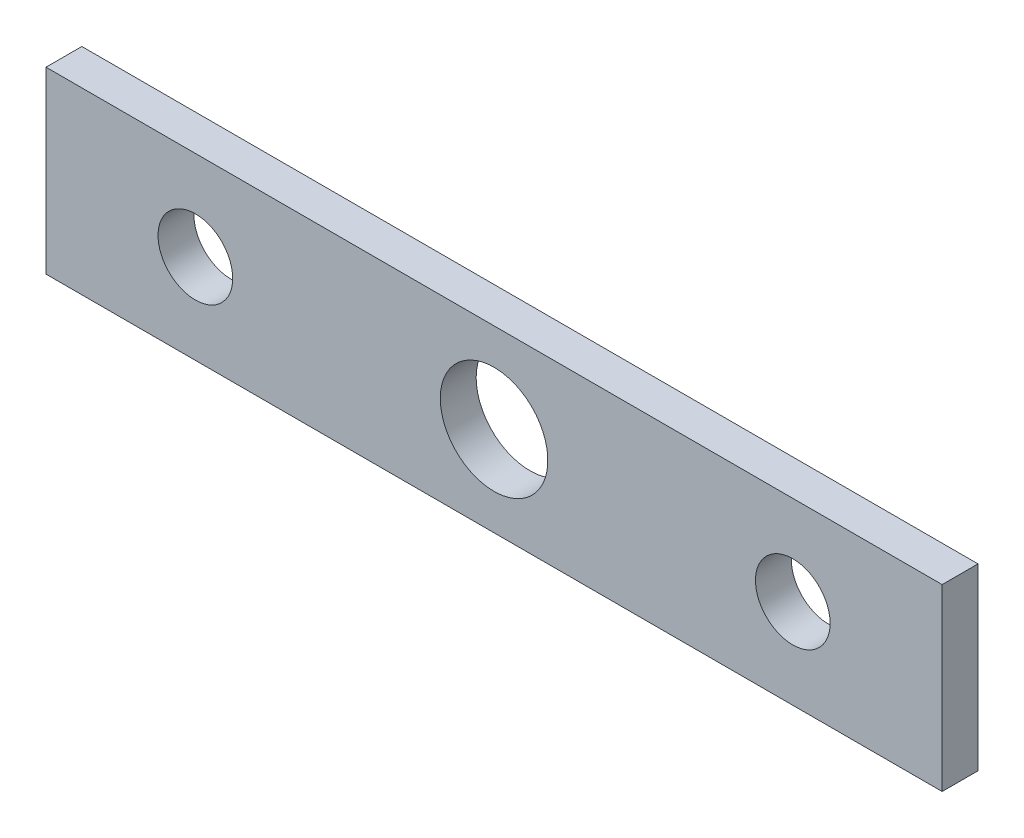
from build123d import *

# Parameters (mm, degrees)
SKETCH_1_W          = 300
SKETCH_1_H          = 60
SKETCH_1_R          = 12.5
EXTRUDE_1_DEPTH     = 12
CUT_EXTRUDE_1_REACH = 155.441
SKETCH_2_R          = 18


with BuildPart() as part:
    # 草图1 → 凸台-拉伸1 (new body)
    with BuildSketch(Plane.XY):
        Rectangle(SKETCH_1_W, SKETCH_1_H)
        with Locations((100, 0)):
            Circle(SKETCH_1_R, mode=Mode.SUBTRACT)
        with Locations((-100, 0)):
            Circle(SKETCH_1_R, mode=Mode.SUBTRACT)
    extrude(amount=EXTRUDE_1_DEPTH)

    # 草图2 → 切除-拉伸1 (cut, up to next)
    with BuildSketch(Plane(origin=(0, 0, 0), x_dir=(-1, 0, 0), z_dir=(0, 0, -1)), mode=Mode.PRIVATE) as cut_extrude_1_sk1:
        Circle(SKETCH_2_R)
    cut_extrude_1_tool1 = extrude(cut_extrude_1_sk1.sketch, amount=-CUT_EXTRUDE_1_REACH, mode=Mode.PRIVATE) & part.part
    add(cut_extrude_1_tool1.solids().sort_by_distance((0, 0, 0))[0], mode=Mode.SUBTRACT)


solid = part.part
